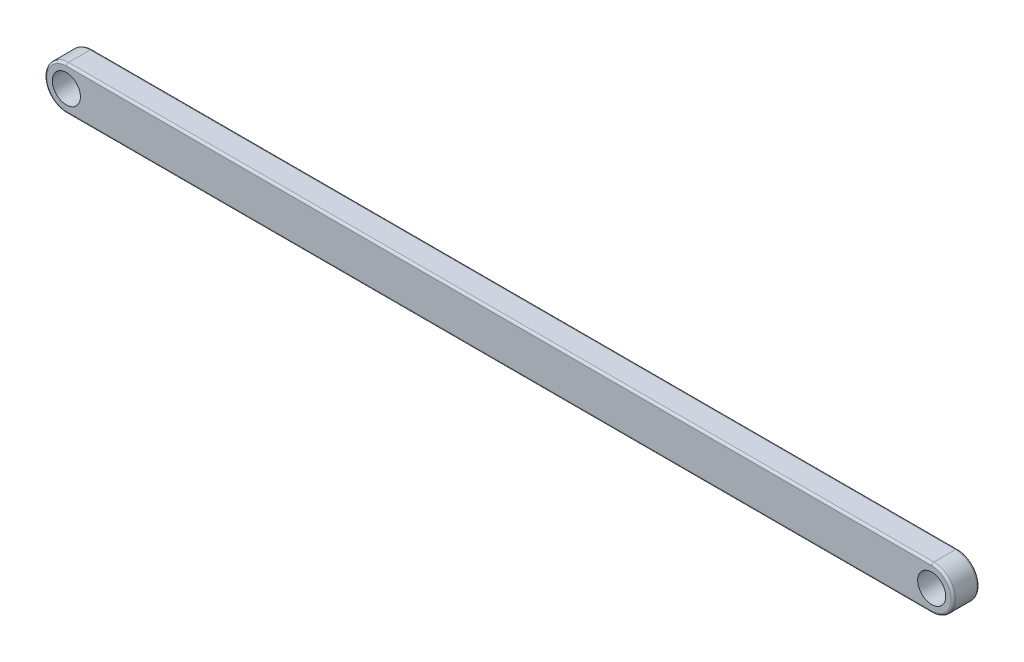
from build123d import *

# Parameters (mm, degrees)
SKETCH1_R           = 3.25
BOSS_EXTRUDE1_DEPTH = 6
FILLET1_R           = 0.5
SCALE_1_SCALE       = 2


with BuildPart() as part:
    # Sketch1 → Boss-Extrude1 (new body)
    with BuildSketch(Plane.XY):
        with BuildLine():
            Line((-50.218340611, 5), (149.781659389, 5))
            ThreePointArc((149.781659389, 5), (154.781659389, 0), (149.781659389, -5))
            Line((149.781659389, -5), (-50.218340611, -5))
            ThreePointArc((-50.218340611, -5), (-55.218340611, 0), (-50.218340611, 5))
        make_face()
        with Locations((-50.218340611, 0)):
            Circle(SKETCH1_R, mode=Mode.SUBTRACT)
        with Locations((149.781659389, 0)):
            Circle(SKETCH1_R, mode=Mode.SUBTRACT)
    extrude(amount=BOSS_EXTRUDE1_DEPTH)

    # Fillet1
    fillet1_edges = [part.edges().sort_by_distance(p)[0] for p in [
        (154.781659389, 0, 6),
        (49.781659389, 5, 6),
        (-55.218340611, 0, 6),
        (49.781659389, 5, 0),
        (154.781659389, 0, 0),
        (49.781659389, -5, 0),
        (-55.218340611, 0, 0),
        (49.781659389, -5, 6),
    ]]
    fillet(fillet1_edges, radius=FILLET1_R)


with BuildPart() as part_1:
    # 缩放比例1: scaled about (49.781659389, 0, 3)
    add(part.part.scale(SCALE_1_SCALE).moved(Location((-49.781659389, 0, -3))))


solid = part_1.part
